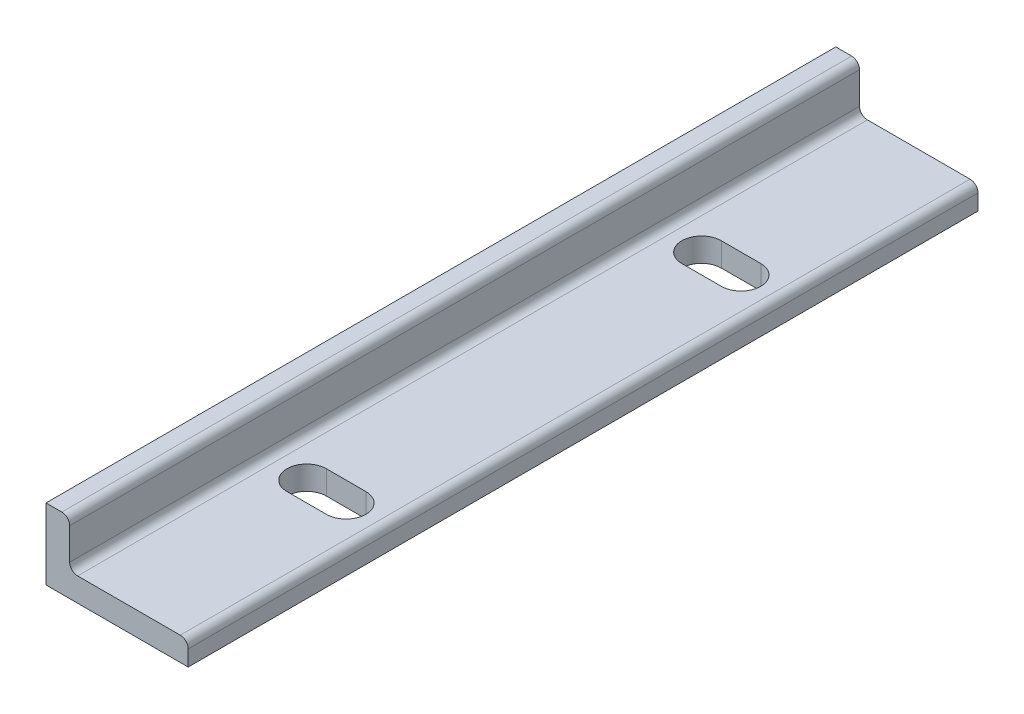
from build123d import *

# Parameters (mm, degrees)
BOSS_EXTRUDE1_DEPTH = 100
FILLET1_R           = 1
SKETCH2_R           = 2.5
CUT_EXTRUDE1_DEPTH  = 102.7840852
CUT_EXTRUDE2_DEPTH  = 102.7840852


with BuildPart() as part:
    # Sketch1 → Boss-Extrude1 (new body)
    with BuildSketch(Plane.XY):
        Polygon((0, 0), (18, 0), (18, 3), (3, 3), (3, 9), (0, 9), align=None)
    extrude(amount=BOSS_EXTRUDE1_DEPTH)

    # Fillet1
    fillet1_edges = [part.edges().sort_by_distance(p)[0] for p in [
        (3, 9, 50),
        (3, 3, 50),
        (18, 3, 50),
    ]]
    fillet(fillet1_edges, radius=FILLET1_R)

    # Sketch2 → Cut-Extrude1 (cut, through all)
    with BuildSketch(Plane(origin=(0, 3, 0), x_dir=(1, 0, 0), z_dir=(0, 1, 0))):
        with Locations(Location((10.5, -25, 0), (0, 0, 180))):
            Circle(SKETCH2_R)
        with Locations(Location((10.5, -75, 0), (0, 0, 180))):
            Circle(SKETCH2_R)
    extrude(amount=-CUT_EXTRUDE1_DEPTH, mode=Mode.SUBTRACT)

    # Sketch3 → Cut-Extrude2 (cut, through all)
    with BuildSketch(Plane(origin=(0, 3, 0), x_dir=(1, 0, 0), z_dir=(0, 1, 0))):
        with BuildLine():
            Line((8, -72.5), (13, -72.5))
            ThreePointArc((13, -72.5), (15.5, -75), (13, -77.5))
            Line((13, -77.5), (8, -77.5))
            ThreePointArc((8, -77.5), (5.5, -75), (8, -72.5))
        make_face()
        with BuildLine():
            Line((8, -27.5), (13, -27.5))
            ThreePointArc((13, -27.5), (15.5, -25), (13, -22.5))
            Line((13, -22.5), (8, -22.5))
            ThreePointArc((8, -22.5), (5.5, -25), (8, -27.5))
        make_face()
    extrude(amount=-CUT_EXTRUDE2_DEPTH, mode=Mode.SUBTRACT)


solid = part.part
